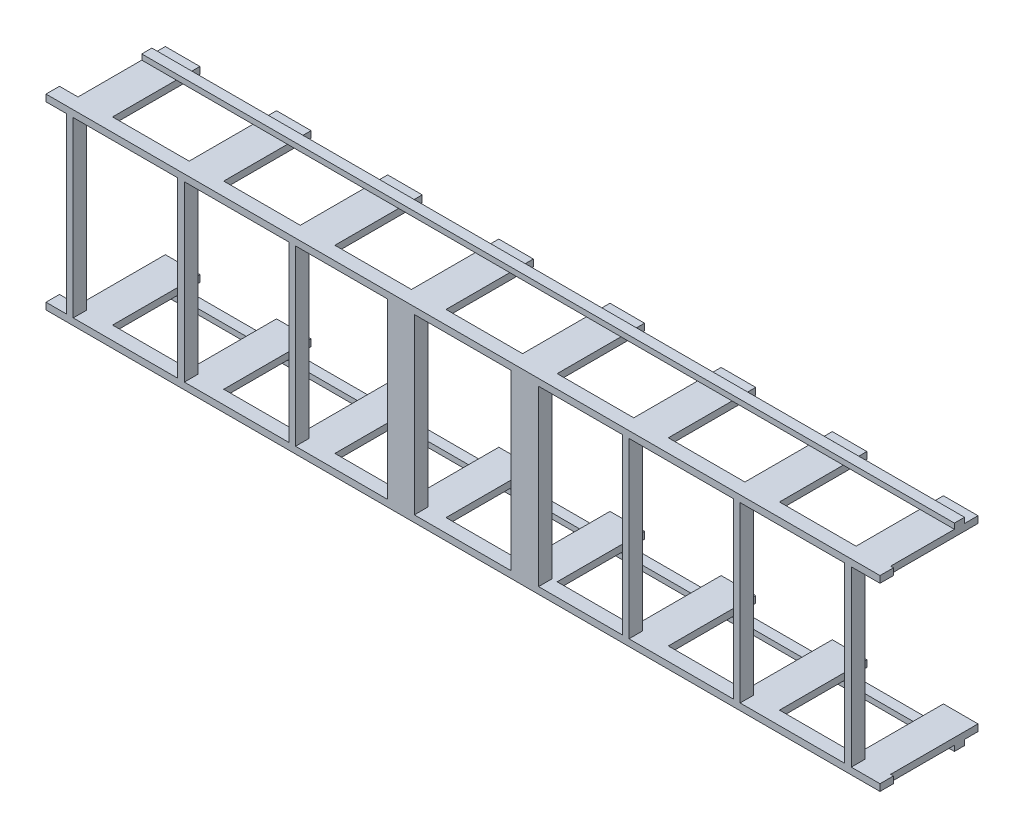
from build123d import *

# Parameters (mm, degrees)
SKETCH1_W             = 6190
SKETCH1_H             = 50
BOSS_EXTRUDE1_DEPTH   = 100
BOSS_EXTRUDE1_2_DEPTH = 100
SKETCH2_W             = 200
SKETCH2_H             = 100
BOSS_EXTRUDE2_DEPTH   = 1388
SKETCH4_W             = 50
SKETCH4_H             = 100
BOSS_EXTRUDE3_DEPTH   = 1288
SKETCH5_W             = 256.6
SKETCH5_H             = 50
BOSS_EXTRUDE4_DEPTH   = 648.4
BOSS_EXTRUDE12_REACH  = 6358.377
SKETCH13_W            = 75
SKETCH13_H            = 40


with BuildPart() as part:
    # Sketch1 → Boss-Extrude1 (new body)
    with BuildSketch(Plane.XY):
        with Locations((3095, 1363)):
            Rectangle(SKETCH1_W, SKETCH1_H)
    extrude(amount=BOSS_EXTRUDE1_DEPTH)



with BuildPart() as body_2:
    # Sketch1 → Boss-Extrude1 2 (new body)
    with BuildSketch(Plane.XY):
        with Locations((3095, 25)):
            Rectangle(SKETCH1_W, SKETCH1_H)
    extrude(amount=BOSS_EXTRUDE1_2_DEPTH)


with BuildPart() as part_1:
    add(part.part)

    add(body_2.part)  # Boss-Extrude2 merges body 2
    # Sketch2 → Boss-Extrude2 (add)
    with BuildSketch(Plane.XZ):
        with Locations((2634, 50)):
            Rectangle(SKETCH2_W, SKETCH2_H)
        with Locations((3556, 50)):
            Rectangle(SKETCH2_W, SKETCH2_H)
    extrude(amount=-BOSS_EXTRUDE2_DEPTH)

    # Sketch4 → Boss-Extrude3 (add)
    with BuildSketch(Plane(origin=(0, 50, 0), x_dir=(1, 0, 0), z_dir=(0, 1, 0))):
        with Locations((177, -50)):
            Rectangle(SKETCH4_W, SKETCH4_H)
        with Locations((1002, -50)):
            Rectangle(SKETCH4_W, SKETCH4_H)
        with Locations((1827, -50)):
            Rectangle(SKETCH4_W, SKETCH4_H)
        with Locations((2652, -50)):
            Rectangle(SKETCH4_W, SKETCH4_H)
        with Locations((3477, -50)):
            Rectangle(SKETCH4_W, SKETCH4_H)
        with Locations((4302, -50)):
            Rectangle(SKETCH4_W, SKETCH4_H)
        with Locations((5127, -50)):
            Rectangle(SKETCH4_W, SKETCH4_H)
        with Locations((5952, -50)):
            Rectangle(SKETCH4_W, SKETCH4_H)
    extrude(amount=BOSS_EXTRUDE3_DEPTH)

    # Sketch5 → Boss-Extrude4 (add)
    with BuildSketch(Plane.XY):
        with Locations((6040.7, 1363)):
            Rectangle(SKETCH5_W, SKETCH5_H)
        with Locations((265.7, 1363)):
            Rectangle(SKETCH5_W, SKETCH5_H)
        with Locations((265.7, 25)):
            Rectangle(SKETCH5_W, SKETCH5_H)
        with Locations((6040.7, 25)):
            Rectangle(SKETCH5_W, SKETCH5_H)
        with Locations((5215.7, 25)):
            Rectangle(SKETCH5_W, SKETCH5_H)
        with Locations((1090.7, 1363)):
            Rectangle(SKETCH5_W, SKETCH5_H)
        with Locations((4390.7, 25)):
            Rectangle(SKETCH5_W, SKETCH5_H)
        with Locations((1915.7, 1363)):
            Rectangle(SKETCH5_W, SKETCH5_H)
        with Locations((3565.7, 25)):
            Rectangle(SKETCH5_W, SKETCH5_H)
        with Locations((2740.7, 1363)):
            Rectangle(SKETCH5_W, SKETCH5_H)
        with Locations((2740.7, 25)):
            Rectangle(SKETCH5_W, SKETCH5_H)
        with Locations((3565.7, 1363)):
            Rectangle(SKETCH5_W, SKETCH5_H)
        with Locations((1915.7, 25)):
            Rectangle(SKETCH5_W, SKETCH5_H)
        with Locations((1090.7, 25)):
            Rectangle(SKETCH5_W, SKETCH5_H)
        with Locations((4390.7, 1363)):
            Rectangle(SKETCH5_W, SKETCH5_H)
        with Locations((5215.7, 1363)):
            Rectangle(SKETCH5_W, SKETCH5_H)
    extrude(amount=-BOSS_EXTRUDE4_DEPTH)

    # Boss-Extrude12: up to this face of the body (flat: up to its plane)
    boss_extrude12_end = Plane(part_1.part.faces().sort_by_distance((137.4, 1363, -324.2))[0])
    # Sketch13 → Boss-Extrude12 (add, up to the picked face)
    with BuildSketch(Plane(origin=(6169, 0, 0), x_dir=(0, 0, -1), z_dir=(1, 0, 0)), mode=Mode.PRIVATE) as boss_extrude12_sk1:
        with Locations((510.9, -20)):
            Rectangle(SKETCH13_W, SKETCH13_H)
    boss_extrude12_tool1 = split(extrude(boss_extrude12_sk1.sketch, amount=-BOSS_EXTRUDE12_REACH, mode=Mode.PRIVATE), bisect_by=boss_extrude12_end, keep=Keep.BOTH, mode=Mode.PRIVATE)
    # Sketch13 → Boss-Extrude12 (add, up to the picked face)
    with BuildSketch(Plane(origin=(6169, 0, 0), x_dir=(0, 0, -1), z_dir=(1, 0, 0)), mode=Mode.PRIVATE) as boss_extrude12_sk2:
        with Locations((510.9, 1408)):
            Rectangle(SKETCH13_W, SKETCH13_H)
    boss_extrude12_tool2 = split(extrude(boss_extrude12_sk2.sketch, amount=-BOSS_EXTRUDE12_REACH, mode=Mode.PRIVATE), bisect_by=boss_extrude12_end, keep=Keep.BOTH, mode=Mode.PRIVATE)
    add(boss_extrude12_tool1.solids().sort_by(Axis((6169, -20, -510.9), (-1, 0, 0)))[0])
    add(boss_extrude12_tool2.solids().sort_by(Axis((6169, 1408, -510.9), (-1, 0, 0)))[0])


solid = part_1.part
